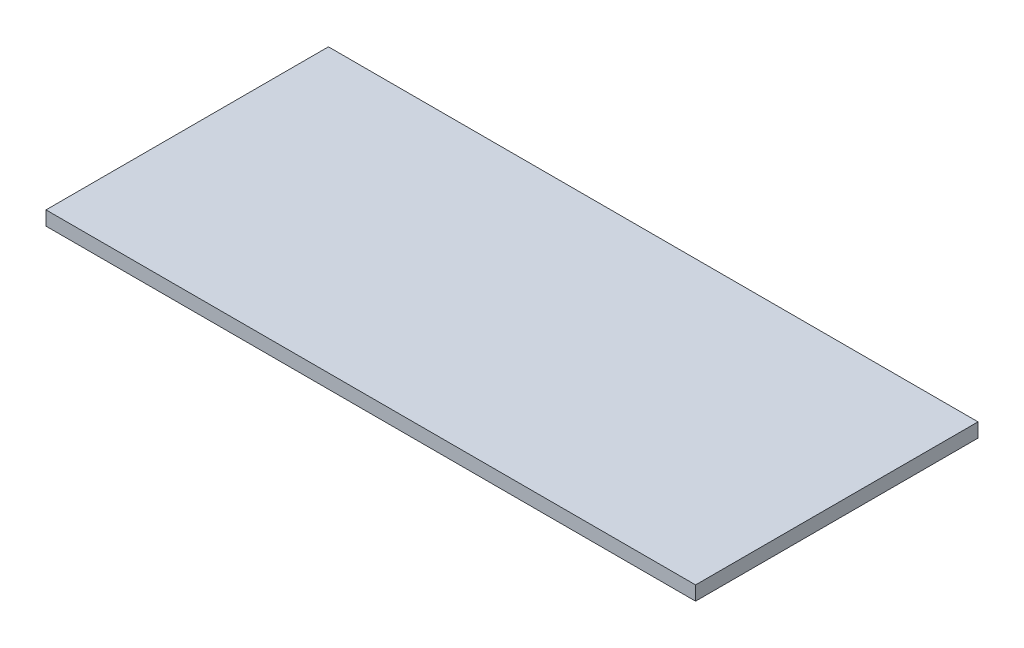
from build123d import *

# Parameters (mm, degrees)
SKETCH1_W           = 584.2
SKETCH1_H           = 254
BOSS_EXTRUDE1_DEPTH = 12.7


with BuildPart() as part:
    # Sketch1 → Boss-Extrude1 (new body)
    with BuildSketch(Plane(origin=(0, 0, 0), x_dir=(1, 0, 0), z_dir=(0, 1, 0))):
        with Locations((0, -127)):
            Rectangle(SKETCH1_W, SKETCH1_H)
    extrude(amount=BOSS_EXTRUDE1_DEPTH)


solid = part.part
